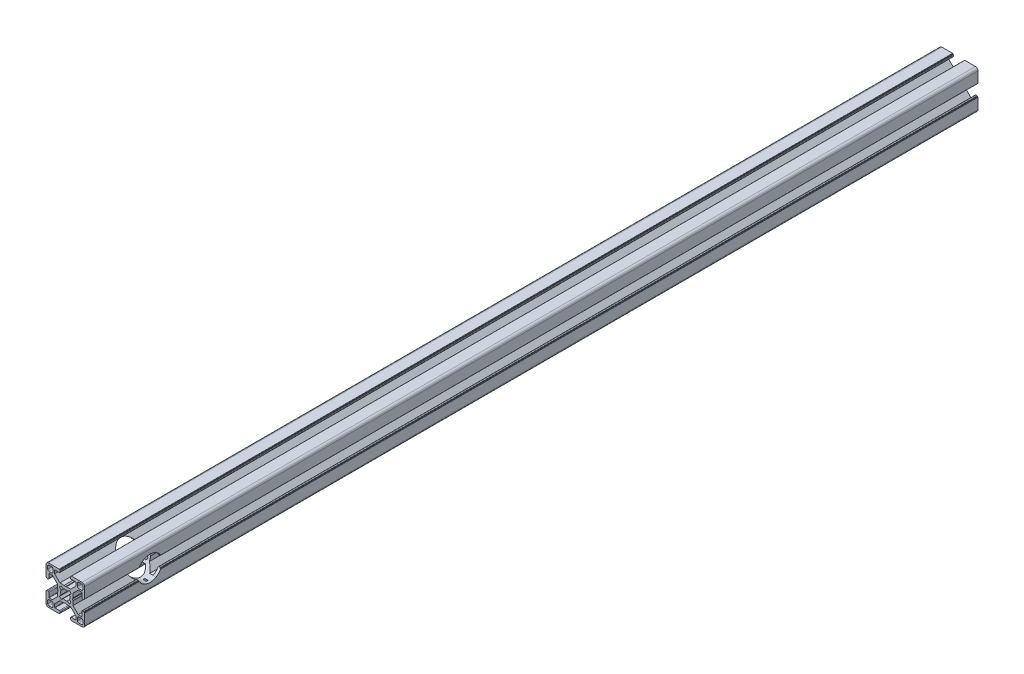
from build123d import *

# Parameters (mm, degrees)
BOSS_EXTRUDE1_DEPTH = 694.69
CUT_EXTRUDE1_REACH  = 697.499
SKETCH3_R           = 9.525


with BuildPart() as part:
    # Sketch1 → Boss-Extrude1 (new body)
    with BuildSketch(Plane.XY):
        with BuildLine():
            Line((6.00446543, 0.899999619), (5.484852164, 0))
            Line((5.484852164, 0), (6.00446543, -0.899999619))
            Line((6.00446543, -0.899999619), (6.00446543, -4.204465866))
            Line((6.00446543, -4.204465866), (10.049999564, -8.25))
            Line((10.049999564, -8.25), (12.59999928, -8.25))
            ThreePointArc((12.59999928, -8.25), (12.741420837, -8.191421273), (12.799999564, -8.049999716))
            Line((12.799999564, -8.049999716), (12.799999564, -4.649999613))
            ThreePointArc((12.799999564, -4.649999613), (12.975735606, -4.225735278), (13.39999994, -4.049999237))
            Line((13.39999994, -4.049999237), (14.300000043, -4.049999237))
            ThreePointArc((14.300000043, -4.049999237), (14.4414216, -4.108577964), (14.500000327, -4.249999521))
            Line((14.500000327, -4.249999521), (14.500000327, -4.349998953))
            ThreePointArc((14.500000327, -4.349998953), (14.558579054, -4.49142051), (14.700000611, -4.549999237))
            Line((14.700000611, -4.549999237), (14.799999716, -4.549999237))
            ThreePointArc((14.799999716, -4.549999237), (14.941421273, -4.608577964), (15, -4.749999521))
            Line((15, -4.749999521), (15, -13.000000346))
            ThreePointArc((15, -13.000000346), (14.414213664, -14.414213664), (13.000000346, -15))
            Line((13.000000346, -15), (4.749999945, -15))
            ThreePointArc((4.749999945, -15), (4.60857832, -14.941421245), (4.549999564, -14.799999619))
            Line((4.549999564, -14.799999619), (4.549999564, -14.69999942))
            ThreePointArc((4.549999564, -14.69999942), (4.49142109, -14.558578474), (4.350000144, -14.5))
            Line((4.350000144, -14.5), (4.250000374, -14.5))
            ThreePointArc((4.250000374, -14.5), (4.108578753, -14.441421247), (4.05, -14.299999626))
            Line((4.05, -14.299999626), (4.05, -13.399999434))
            ThreePointArc((4.05, -13.399999434), (4.225735989, -12.975735226), (4.650000197, -12.799999237))
            Line((4.650000197, -12.799999237), (8.049999924, -12.799999237))
            ThreePointArc((8.049999924, -12.799999237), (8.191421565, -12.741420475), (8.250000327, -12.599998834))
            Line((8.250000327, -12.599998834), (8.250000327, -10.049999237))
            Line((8.250000327, -10.049999237), (4.204466193, -6))
            Line((4.204466193, -6), (0.899999946, -6))
            Line((0.899999946, -6), (0, -5.484851837))
            Line((0, -5.484851837), (-0.899999946, -6))
            Line((-0.899999946, -6), (-4.204466193, -6))
            Line((-4.204466193, -6), (-8.250000327, -10.049999237))
            Line((-8.250000327, -10.049999237), (-8.250000327, -12.599998834))
            ThreePointArc((-8.250000327, -12.599998834), (-8.191421565, -12.741420475), (-8.049999924, -12.799999237))
            Line((-8.049999924, -12.799999237), (-4.650000197, -12.799999237))
            ThreePointArc((-4.650000197, -12.799999237), (-4.225735989, -12.975735226), (-4.05, -13.399999434))
            Line((-4.05, -13.399999434), (-4.05, -14.299999626))
            ThreePointArc((-4.05, -14.299999626), (-4.108578753, -14.441421247), (-4.250000374, -14.5))
            Line((-4.250000374, -14.5), (-4.350000144, -14.5))
            ThreePointArc((-4.350000144, -14.5), (-4.49142109, -14.558578474), (-4.549999564, -14.69999942))
            Line((-4.549999564, -14.69999942), (-4.549999564, -14.799999619))
            ThreePointArc((-4.549999564, -14.799999619), (-4.60857832, -14.941421245), (-4.749999945, -15))
            Line((-4.749999945, -15), (-13.000000346, -15))
            ThreePointArc((-13.000000346, -15), (-14.414213664, -14.414213664), (-15, -13.000000346))
            Line((-15, -13.000000346), (-15, -4.749999521))
            ThreePointArc((-15, -4.749999521), (-14.941421273, -4.608577964), (-14.799999716, -4.549999237))
            Line((-14.799999716, -4.549999237), (-14.700000611, -4.549999237))
            ThreePointArc((-14.700000611, -4.549999237), (-14.558579054, -4.49142051), (-14.500000327, -4.349998953))
            Line((-14.500000327, -4.349998953), (-14.500000327, -4.249999521))
            ThreePointArc((-14.500000327, -4.249999521), (-14.4414216, -4.108577964), (-14.300000043, -4.049999237))
            Line((-14.300000043, -4.049999237), (-13.39999994, -4.049999237))
            ThreePointArc((-13.39999994, -4.049999237), (-12.975735606, -4.225735278), (-12.799999564, -4.649999613))
            Line((-12.799999564, -4.649999613), (-12.799999564, -8.049999716))
            ThreePointArc((-12.799999564, -8.049999716), (-12.741420837, -8.191421273), (-12.59999928, -8.25))
            Line((-12.59999928, -8.25), (-10.049999564, -8.25))
            Line((-10.049999564, -8.25), (-6.00446543, -4.204465866))
            Line((-6.00446543, -4.204465866), (-6.00446543, -0.899999619))
            Line((-6.00446543, -0.899999619), (-5.484852164, 0))
            Line((-5.484852164, 0), (-6.00446543, 0.899999619))
            Line((-6.00446543, 0.899999619), (-6.00446543, 4.204465866))
            Line((-6.00446543, 4.204465866), (-10.049999564, 8.25))
            Line((-10.049999564, 8.25), (-12.59999928, 8.25))
            ThreePointArc((-12.59999928, 8.25), (-12.741420837, 8.191421273), (-12.799999564, 8.049999716))
            Line((-12.799999564, 8.049999716), (-12.799999564, 4.649999613))
            ThreePointArc((-12.799999564, 4.649999613), (-12.975735606, 4.225735278), (-13.39999994, 4.049999237))
            Line((-13.39999994, 4.049999237), (-14.300000043, 4.049999237))
            ThreePointArc((-14.300000043, 4.049999237), (-14.4414216, 4.108577964), (-14.500000327, 4.249999521))
            Line((-14.500000327, 4.249999521), (-14.500000327, 4.349998953))
            ThreePointArc((-14.500000327, 4.349998953), (-14.558579054, 4.49142051), (-14.700000611, 4.549999237))
            Line((-14.700000611, 4.549999237), (-14.799999716, 4.549999237))
            ThreePointArc((-14.799999716, 4.549999237), (-14.941421273, 4.608577964), (-15, 4.749999521))
            Line((-15, 4.749999521), (-15, 13.000000346))
            ThreePointArc((-15, 13.000000346), (-14.414213664, 14.414213664), (-13.000000346, 15))
            Line((-13.000000346, 15), (-4.749999945, 15))
            ThreePointArc((-4.749999945, 15), (-4.60857832, 14.941421245), (-4.549999564, 14.799999619))
            Line((-4.549999564, 14.799999619), (-4.549999564, 14.69999942))
            ThreePointArc((-4.549999564, 14.69999942), (-4.49142109, 14.558578474), (-4.350000144, 14.5))
            Line((-4.350000144, 14.5), (-4.250000374, 14.5))
            ThreePointArc((-4.250000374, 14.5), (-4.108578753, 14.441421247), (-4.05, 14.299999626))
            Line((-4.05, 14.299999626), (-4.05, 13.399999434))
            ThreePointArc((-4.05, 13.399999434), (-4.225735989, 12.975735226), (-4.650000197, 12.799999237))
            Line((-4.650000197, 12.799999237), (-8.049999924, 12.799999237))
            ThreePointArc((-8.049999924, 12.799999237), (-8.191421565, 12.741420475), (-8.250000327, 12.599998834))
            Line((-8.250000327, 12.599998834), (-8.250000327, 10.049999237))
            Line((-8.250000327, 10.049999237), (-4.204466193, 6))
            Line((-4.204466193, 6), (-0.899999946, 6))
            Line((-0.899999946, 6), (0, 5.484851837))
            Line((0, 5.484851837), (0.899999946, 6))
            Line((0.899999946, 6), (4.204466193, 6))
            Line((4.204466193, 6), (8.250000327, 10.049999237))
            Line((8.250000327, 10.049999237), (8.250000327, 12.599998834))
            ThreePointArc((8.250000327, 12.599998834), (8.191421565, 12.741420475), (8.049999924, 12.799999237))
            Line((8.049999924, 12.799999237), (4.650000197, 12.799999237))
            ThreePointArc((4.650000197, 12.799999237), (4.225735989, 12.975735226), (4.05, 13.399999434))
            Line((4.05, 13.399999434), (4.05, 14.299999626))
            ThreePointArc((4.05, 14.299999626), (4.108578753, 14.441421247), (4.250000374, 14.5))
            Line((4.250000374, 14.5), (4.350000144, 14.5))
            ThreePointArc((4.350000144, 14.5), (4.49142109, 14.558578474), (4.549999564, 14.69999942))
            Line((4.549999564, 14.69999942), (4.549999564, 14.799999619))
            ThreePointArc((4.549999564, 14.799999619), (4.60857832, 14.941421245), (4.749999945, 15))
            Line((4.749999945, 15), (13.000000346, 15))
            ThreePointArc((13.000000346, 15), (14.414213664, 14.414213664), (15, 13.000000346))
            Line((15, 13.000000346), (15, 4.749999521))
            ThreePointArc((15, 4.749999521), (14.941421273, 4.608577964), (14.799999716, 4.549999237))
            Line((14.799999716, 4.549999237), (14.700000611, 4.549999237))
            ThreePointArc((14.700000611, 4.549999237), (14.558579054, 4.49142051), (14.500000327, 4.349998953))
            Line((14.500000327, 4.349998953), (14.500000327, 4.249999521))
            ThreePointArc((14.500000327, 4.249999521), (14.4414216, 4.108577964), (14.300000043, 4.049999237))
            Line((14.300000043, 4.049999237), (13.39999994, 4.049999237))
            ThreePointArc((13.39999994, 4.049999237), (12.975735606, 4.225735278), (12.799999564, 4.649999613))
            Line((12.799999564, 4.649999613), (12.799999564, 8.049999716))
            ThreePointArc((12.799999564, 8.049999716), (12.741420837, 8.191421273), (12.59999928, 8.25))
            Line((12.59999928, 8.25), (10.049999564, 8.25))
            Line((10.049999564, 8.25), (6.00446543, 4.204465866))
            Line((6.00446543, 4.204465866), (6.00446543, 0.899999619))
        make_face()
        with BuildLine():
            Line((13.70000109, 12.700000398), (13.70000109, 10.499999635))
            ThreePointArc((13.70000109, 10.499999635), (13.407107874, 9.792892851), (12.70000109, 9.499999635))
            Line((12.70000109, 9.499999635), (10.500000327, 9.499999635))
            ThreePointArc((10.500000327, 9.499999635), (9.792893543, 9.792892851), (9.500000327, 10.499999635))
            Line((9.500000327, 10.499999635), (9.500000327, 12.700000398))
            ThreePointArc((9.500000327, 12.700000398), (9.792893543, 13.407107182), (10.500000327, 13.700000398))
            Line((10.500000327, 13.700000398), (12.70000109, 13.700000398))
            ThreePointArc((12.70000109, 13.700000398), (13.407107874, 13.407107182), (13.70000109, 12.700000398))
        make_face(mode=Mode.SUBTRACT)
        with BuildLine():
            Line((3.135929412, 4.518400903), (1.600129524, 3.280561767))
            ThreePointArc((1.600129524, 3.280561767), (0, 3.65), (-1.600129524, 3.280561767))
            Line((-1.600129524, 3.280561767), (-3.135929412, 4.518400903))
            ThreePointArc((-3.135929412, 4.518400903), (-3.881002259, 3.897155561), (-4.505336892, 3.154669473))
            Line((-4.505336892, 3.154669473), (-3.280561732, 1.600129597))
            ThreePointArc((-3.280561732, 1.600129597), (-3.65, 0), (-3.280561732, -1.600129597))
            Line((-3.280561732, -1.600129597), (-4.505336892, -3.154669473))
            ThreePointArc((-4.505336892, -3.154669473), (-3.881002259, -3.897155561), (-3.135929412, -4.518400903))
            Line((-3.135929412, -4.518400903), (-1.600129524, -3.280561767))
            ThreePointArc((-1.600129524, -3.280561767), (0, -3.65), (1.600129524, -3.280561767))
            Line((1.600129524, -3.280561767), (3.135929412, -4.518400903))
            ThreePointArc((3.135929412, -4.518400903), (3.881002259, -3.897155561), (4.505336892, -3.154669473))
            Line((4.505336892, -3.154669473), (3.280561732, -1.600129597))
            ThreePointArc((3.280561732, -1.600129597), (3.65, 0), (3.280561732, 1.600129597))
            Line((3.280561732, 1.600129597), (4.505336892, 3.154669473))
            ThreePointArc((4.505336892, 3.154669473), (3.881002259, 3.897155561), (3.135929412, 4.518400903))
        make_face(mode=Mode.SUBTRACT)
        with BuildLine():
            Line((-13.70000109, -12.700000398), (-13.70000109, -10.499999635))
            ThreePointArc((-13.70000109, -10.499999635), (-13.407107874, -9.792892851), (-12.70000109, -9.499999635))
            Line((-12.70000109, -9.499999635), (-10.500000327, -9.499999635))
            ThreePointArc((-10.500000327, -9.499999635), (-9.792893543, -9.792892851), (-9.500000327, -10.499999635))
            Line((-9.500000327, -10.499999635), (-9.500000327, -12.700000398))
            ThreePointArc((-9.500000327, -12.700000398), (-9.792893543, -13.407107182), (-10.500000327, -13.700000398))
            Line((-10.500000327, -13.700000398), (-12.70000109, -13.700000398))
            ThreePointArc((-12.70000109, -13.700000398), (-13.407107874, -13.407107182), (-13.70000109, -12.700000398))
        make_face(mode=Mode.SUBTRACT)
        with BuildLine():
            Line((10.500000327, -13.700000398), (12.70000109, -13.700000398))
            ThreePointArc((12.70000109, -13.700000398), (13.407107874, -13.407107182), (13.70000109, -12.700000398))
            Line((13.70000109, -12.700000398), (13.70000109, -10.499999635))
            ThreePointArc((13.70000109, -10.499999635), (13.407107874, -9.792892851), (12.70000109, -9.499999635))
            Line((12.70000109, -9.499999635), (10.500000327, -9.499999635))
            ThreePointArc((10.500000327, -9.499999635), (9.792893543, -9.792892851), (9.500000327, -10.499999635))
            Line((9.500000327, -10.499999635), (9.500000327, -12.700000398))
            ThreePointArc((9.500000327, -12.700000398), (9.792893543, -13.407107182), (10.500000327, -13.700000398))
        make_face(mode=Mode.SUBTRACT)
        with BuildLine():
            Line((-10.500000327, 13.700000398), (-12.70000109, 13.700000398))
            ThreePointArc((-12.70000109, 13.700000398), (-13.407107874, 13.407107182), (-13.70000109, 12.700000398))
            Line((-13.70000109, 12.700000398), (-13.70000109, 10.499999635))
            ThreePointArc((-13.70000109, 10.499999635), (-13.407107874, 9.792892851), (-12.70000109, 9.499999635))
            Line((-12.70000109, 9.499999635), (-10.500000327, 9.499999635))
            ThreePointArc((-10.500000327, 9.499999635), (-9.792893543, 9.792892851), (-9.500000327, 10.499999635))
            Line((-9.500000327, 10.499999635), (-9.500000327, 12.700000398))
            ThreePointArc((-9.500000327, 12.700000398), (-9.792893543, 13.407107182), (-10.500000327, 13.700000398))
        make_face(mode=Mode.SUBTRACT)
    extrude(amount=BOSS_EXTRUDE1_DEPTH)

    # Sketch3 → Cut-Extrude1 (cut, up to next)
    with BuildSketch(Plane.ZY.offset(15), mode=Mode.PRIVATE) as cut_extrude1_sk1:
        with Locations(Location((643.89, 0, 0), (0, 0, 240.013332951))):
            Circle(SKETCH3_R)
    cut_extrude1_tool1 = extrude(cut_extrude1_sk1.sketch, amount=-CUT_EXTRUDE1_REACH, mode=Mode.PRIVATE) & part.part
    add(cut_extrude1_tool1.solids().sort_by_distance((-15, 0, 643.89))[0], mode=Mode.SUBTRACT)


solid = part.part
